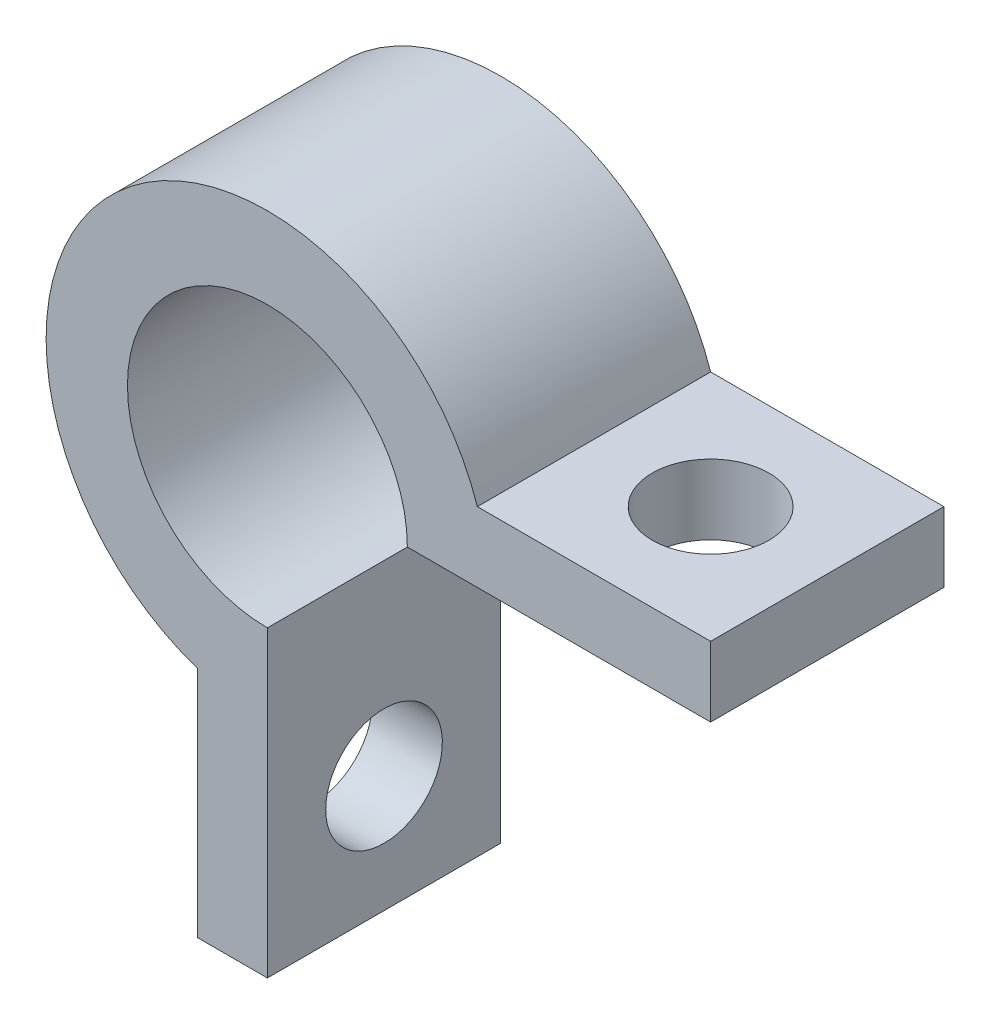
from build123d import *

# Parameters (mm, degrees)
BOSS_EXTRUDE1_DEPTH = 12.7
SKETCH2_R           = 3.175
CUT_EXTRUDE1_DEPTH  = 40.040882418
SKETCH3_R           = 3.175
CUT_EXTRUDE2_DEPTH  = 37.452362817


with BuildPart() as part:
    # Sketch1 → Boss-Extrude1 (new body)
    with BuildSketch(Plane.XY):
        with BuildLine():
            Line((-3.81, -3.81), (-3.81, -16.51))
            Line((-3.81, -16.51), (0, -16.51))
            Line((0, -16.51), (0, 0))
            ThreePointArc((0, 0), (-5.388153673, 13.008153673), (7.62, 7.62))
            Line((7.62, 7.62), (24.13, 7.62))
            Line((24.13, 7.62), (24.13, 11.43))
            Line((24.13, 11.43), (11.43, 11.43))
            ThreePointArc((11.43, 11.43), (-8.519418994, 16.139418994), (-3.81, -3.81))
        make_face()
    extrude(amount=BOSS_EXTRUDE1_DEPTH)

    # Sketch2 → Cut-Extrude1 (cut, through all)
    with BuildSketch(Plane(origin=(0, 11.43, 0), x_dir=(1, 0, 0), z_dir=(0, 1, 0))):
        with Locations(Location((17.78, -6.35, 0), (0, 0, 270))):
            Circle(SKETCH2_R)
    extrude(amount=-CUT_EXTRUDE1_DEPTH, mode=Mode.SUBTRACT)

    # Sketch3 → Cut-Extrude2 (cut, through all)
    with BuildSketch(Plane.ZY.offset(3.81)):
        with Locations((6.35, -10.16)):
            Circle(SKETCH3_R)
    extrude(amount=-CUT_EXTRUDE2_DEPTH, mode=Mode.SUBTRACT)


solid = part.part
